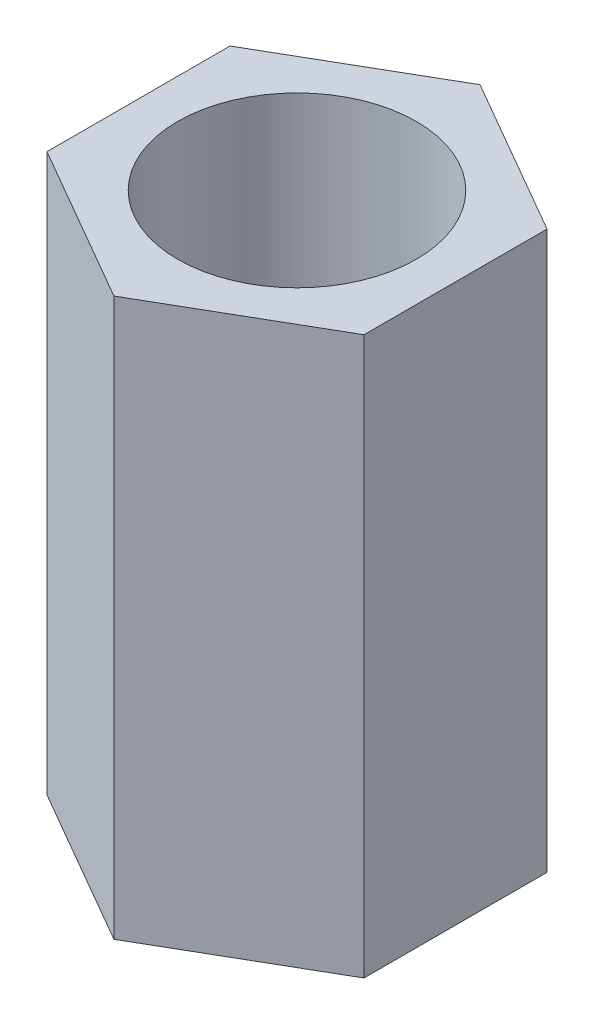
from build123d import *

# Parameters (mm, degrees)
SKETCH_1_R      = 1.5
EXTRUDE_1_DEPTH = 7


with BuildPart() as part:
    # 草图1 → 凸台-拉伸1 (new body)
    with BuildSketch(Plane(origin=(0, 0, 0), x_dir=(1, 0, 0), z_dir=(0, 1, 0))):
        Polygon((1.991858429, 1.15), (0, 2.3), (-1.991858429, 1.15), (-1.991858429, -1.15), (0, -2.3), (1.991858429, -1.15), align=None)
        with Locations(Location((0, 0, 0), (0, 0, 270))):
            Circle(SKETCH_1_R, mode=Mode.SUBTRACT)
    extrude(amount=EXTRUDE_1_DEPTH)


solid = part.part
